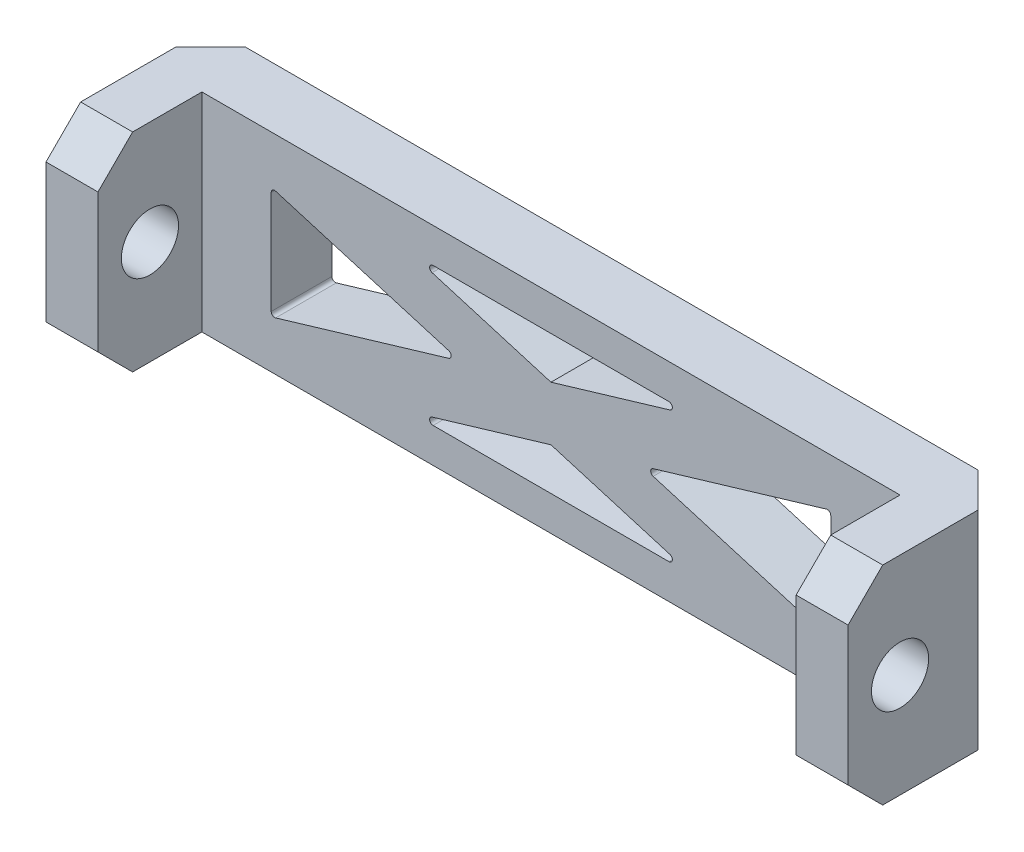
from build123d import *

# Parameters (mm, degrees)
SKETCH_1_W               = 46.3
SKETCH_1_H               = 12
EXTRUDE_1_DEPTH          = 3.5
SKETCH_2_W               = 3
SKETCH_2_H               = 12
EXTRUDE_2_DEPTH          = 6
CUT_EXTRUDE_1_DEPTH      = 45.734103322
CUT_EXTRUDE_1_DEPTH_BACK = 45.734103322
SKETCH_3_R               = 1.65
CHAMFER_1_SIZE           = 2
CHAMFER_2_SIZE           = 2
CUT_EXTRUDE_2_DEPTH      = 25.656084442
CUT_EXTRUDE_2_DEPTH_BACK = 25.656084442
FILLET_1_R               = 0.2


with BuildPart() as part:
    # 草图1 → 凸台-拉伸1 (new body)
    with BuildSketch(Plane.XY):
        Rectangle(SKETCH_1_W, SKETCH_1_H)
    extrude(amount=EXTRUDE_1_DEPTH)

    # 草图2 → 凸台-拉伸2 (add)
    with BuildSketch(Plane.XY.offset(3.5)):
        with Locations((-21.65, 0)):
            Rectangle(SKETCH_2_W, SKETCH_2_H)
        with Locations((21.65, 0)):
            Rectangle(SKETCH_2_W, SKETCH_2_H)
    extrude(amount=EXTRUDE_2_DEPTH)

    # 草图3 → 切除-拉伸1 (cut, two sides: drawn at the far end of the back side and taken through both)
    with BuildSketch(Plane(origin=(-20.15, 0, 0), x_dir=(0, 0, -1), z_dir=(1, 0, 0)).offset(-CUT_EXTRUDE_1_DEPTH_BACK)):
        with Locations((-6.5, 0.001559283)):
            Circle(SKETCH_3_R)
    extrude(amount=CUT_EXTRUDE_1_DEPTH + CUT_EXTRUDE_1_DEPTH_BACK, mode=Mode.SUBTRACT)

    # 倒角1
    chamfer_1_edges = [part.edges().sort_by_distance(p)[0] for p in [
        (-23.15, 0, 0),
        (23.15, 0, 0),
    ]]
    chamfer(chamfer_1_edges, length=CHAMFER_1_SIZE)

    # 倒角2
    chamfer_2_edges = [part.edges().sort_by_distance(p)[0] for p in [
        (-21.65, -6, 9.5),
        (-21.65, 6, 9.5),
        (21.65, 6, 9.5),
        (21.65, -6, 9.5),
    ]]
    chamfer(chamfer_2_edges, length=CHAMFER_2_SIZE)

    # 草图4 → 切除-拉伸2 (cut, two sides: drawn at the far end of the back side and taken through both)
    with BuildSketch(Plane.XY.offset(3.5).offset(-CUT_EXTRUDE_2_DEPTH_BACK)):
        Polygon((-8.177250548, 4), (8.177250548, 4), (0, 1.565086686), align=None)
        Polygon((-16.15, 3.243846317), (-16.15, -3.243846317), (-5.256082786, 0), align=None)
        Polygon((8.177250548, -4), (0, -1.565086686), (-8.177250548, -4), align=None)
        Polygon((16.15, -3.243846317), (5.256082786, 0), (16.15, 3.243846317), align=None)
    extrude(amount=CUT_EXTRUDE_2_DEPTH + CUT_EXTRUDE_2_DEPTH_BACK, mode=Mode.SUBTRACT)

    # 圆角1
    fillet_1_edges = [part.edges().sort_by_distance(p)[0] for p in [
        (-8.177250548, 4, 1.75),
        (8.177250548, 4, 1.75),
        (8.177250548, -4, 1.75),
        (-8.177250548, -4, 1.75),
        (16.15, 3.243846317, 1.75),
        (16.15, -3.243846317, 1.75),
        (5.256082786, 0, 1.75),
        (-16.15, 3.243846317, 1.75),
        (-5.256082786, 0, 1.75),
        (-16.15, -3.243846317, 1.75),
    ]]
    fillet(fillet_1_edges, radius=FILLET_1_R)


solid = part.part
